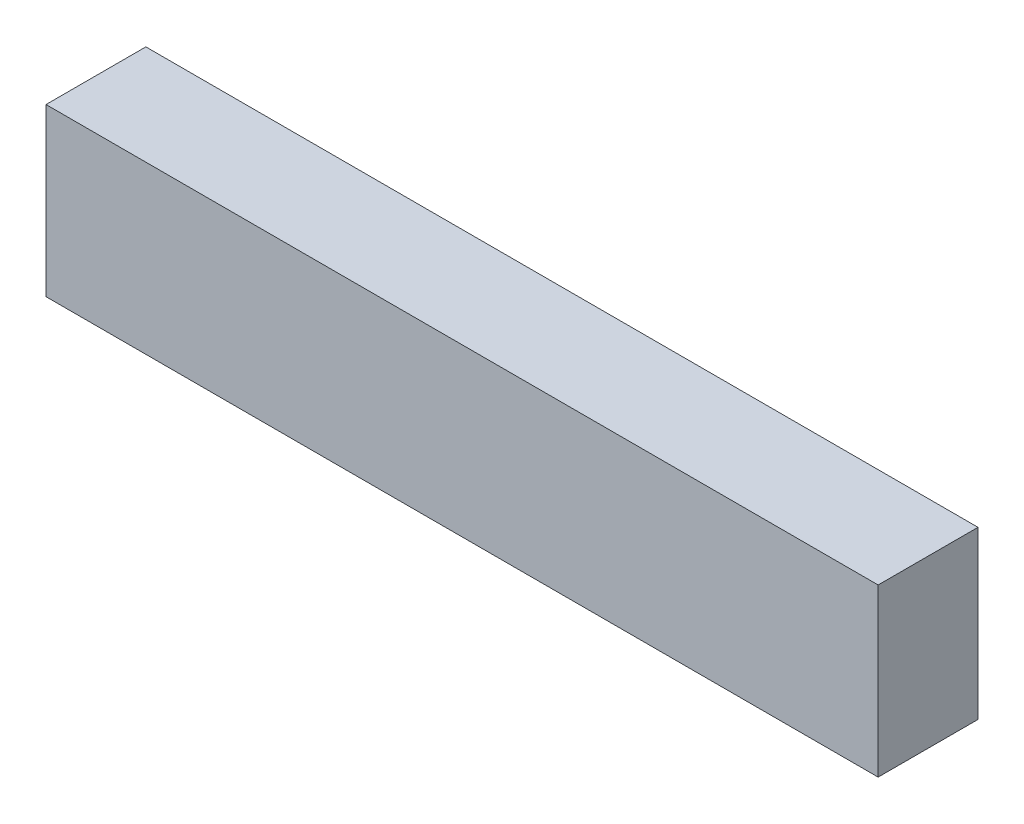
from build123d import *

# Parameters (mm, degrees)
ESQUISSE1_W        = 50
ESQUISSE1_H        = 10
BOSS_EXTRU_1_DEPTH = 6


with BuildPart() as part:
    # Esquisse1 → Boss.-Extru.1 (new body)
    with BuildSketch(Plane.XY):
        with Locations((-25, 5)):
            Rectangle(ESQUISSE1_W, ESQUISSE1_H)
    extrude(amount=BOSS_EXTRU_1_DEPTH)


solid = part.part
